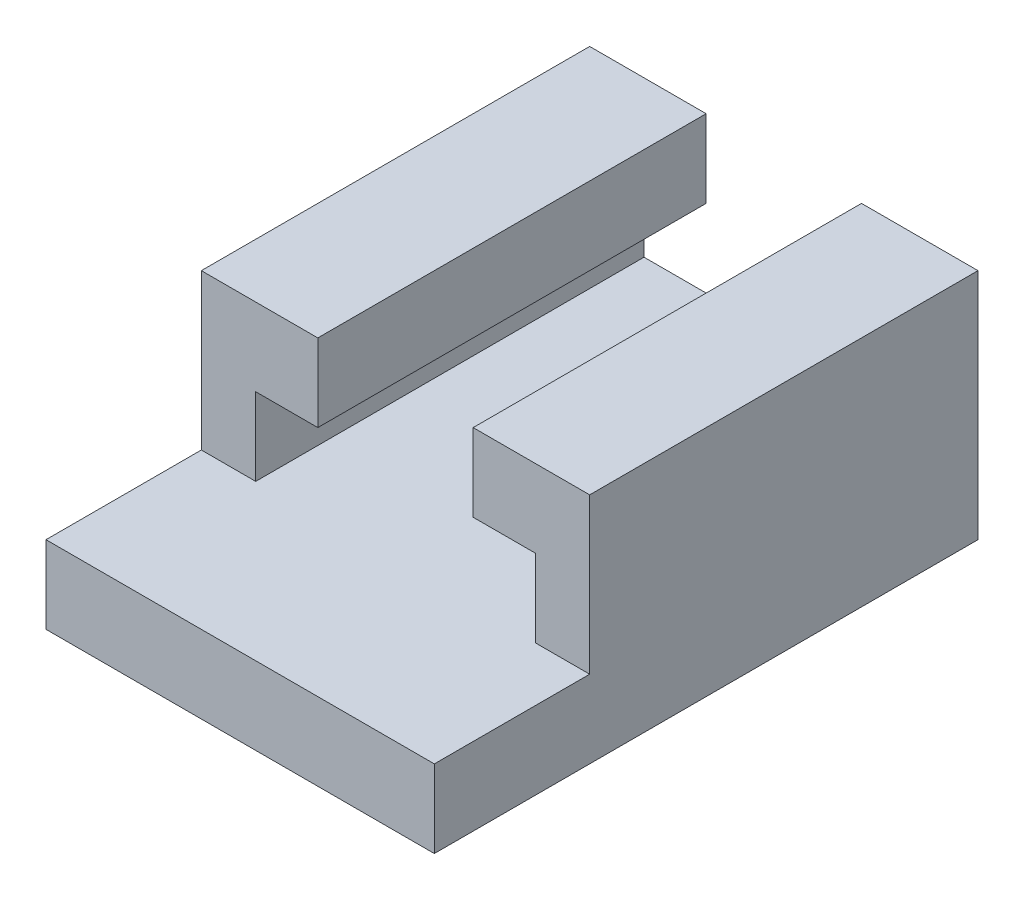
from build123d import *

# Parameters (mm, degrees)
SKETCH1_W           = 5
SKETCH1_H           = 7
BOSS_EXTRUDE1_DEPTH = 3
SKETCH2_W           = 2
SKETCH2_H           = 7
CUT_EXTRUDE1_DEPTH  = 2
SKETCH3_W           = 3.6
SKETCH3_H           = 1
CUT_EXTRUDE2_DEPTH  = 9.786829282
SKETCH4_W           = 5
SKETCH4_H           = 2
CUT_EXTRUDE3_DEPTH  = 2


with BuildPart() as part:
    # Sketch1 → Boss-Extrude1 (new body)
    with BuildSketch(Plane(origin=(0, 0, 0), x_dir=(1, 0, 0), z_dir=(0, 1, 0))):
        with Locations((1.882735313, 5.351794061)):
            Rectangle(SKETCH1_W, SKETCH1_H)
    extrude(amount=BOSS_EXTRUDE1_DEPTH)

    # Sketch2 → Cut-Extrude1 (cut)
    with BuildSketch(Plane(origin=(0, 3, 0), x_dir=(1, 0, 0), z_dir=(0, 1, 0))):
        with Locations((1.882735313, 5.351794061)):
            Rectangle(SKETCH2_W, SKETCH2_H)
    extrude(amount=-CUT_EXTRUDE1_DEPTH, mode=Mode.SUBTRACT)

    # Sketch3 → Cut-Extrude2 (cut, through all)
    with BuildSketch(Plane(origin=(0, 0, -8.851794061), x_dir=(-1, 0, 0), z_dir=(0, 0, -1))):
        with Locations((-1.882735313, 1.5)):
            Rectangle(SKETCH3_W, SKETCH3_H)
    extrude(amount=-CUT_EXTRUDE2_DEPTH, mode=Mode.SUBTRACT)

    # Sketch4 → Cut-Extrude3 (cut)
    with BuildSketch(Plane.XY.offset(-1.851794061)):
        with Locations((1.882735313, 2)):
            Rectangle(SKETCH4_W, SKETCH4_H)
    extrude(amount=-CUT_EXTRUDE3_DEPTH, mode=Mode.SUBTRACT)


solid = part.part
